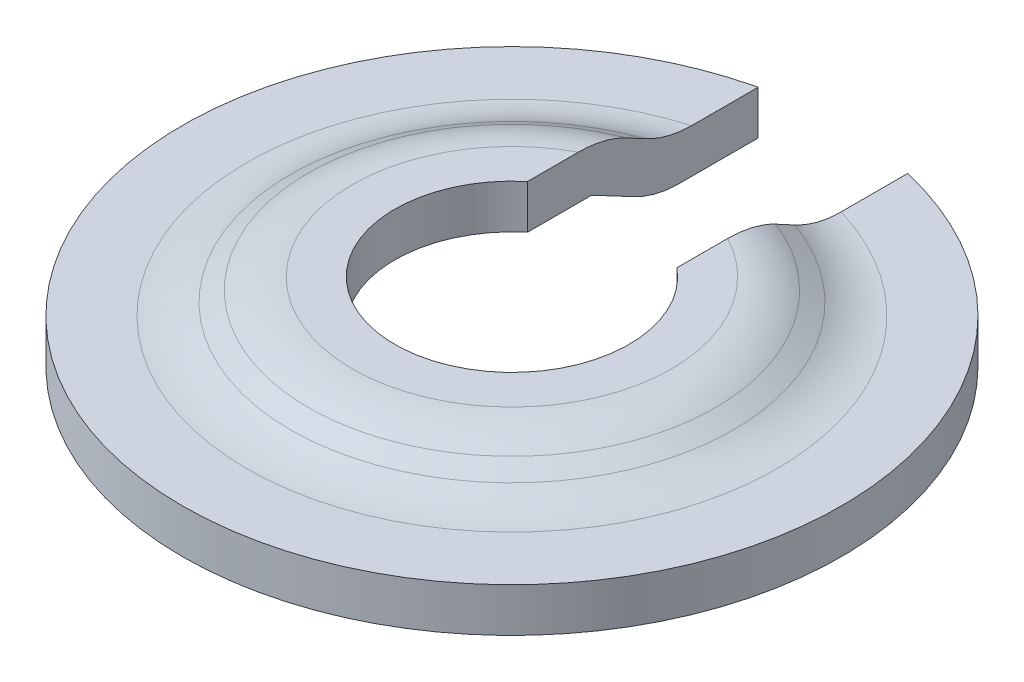
from build123d import *

# Parameters (mm, degrees)
CUT_EXTRUDE1_DEPTH = 33.258177258
FILLET1_R          = 6


with BuildPart() as part:
    # Sketch2 → Revolve1 (revolve)
    with BuildSketch(Plane.XY, mode=Mode.PRIVATE) as revolve1_sk:
        Polygon((8, 2.3), (8, 5.3), (12.5, 5.3), (16.5, 3), (22.5, 3), (22.5, 0), (15.698988524, 0), (11.698988524, 2.3), align=None)
    revolve(revolve1_sk.sketch.rotate(Axis((0, 0, 0), (0, 1, 0)), 90), axis=Axis((0, 0, 0), (0, 1, 0)))

    # Sketch3 → Cut-Extrude1 (cut, through all)
    with BuildSketch(Plane(origin=(0, 0, 0), x_dir=(1, 0, 0), z_dir=(0, 1, 0))):
        with BuildLine():
            Line((-5.1, 21.914378841), (-5.1, 6.163602842))
            ThreePointArc((-5.1, 6.163602842), (0, 8), (5.1, 6.163602842))
            Line((5.1, 6.163602842), (5.1, 21.914378841))
            ThreePointArc((5.1, 21.914378841), (0, 22.5), (-5.1, 21.914378841))
        make_face()
    extrude(amount=CUT_EXTRUDE1_DEPTH, mode=Mode.SUBTRACT)

    # Fillet1
    fillet1_edges = [part.edges().sort_by_distance(p)[0] for p in [
        (0, 0, 15.698988524),
        (0, 3, 16.5),
        (0, 5.3, 12.5),
    ]]
    fillet(fillet1_edges, radius=FILLET1_R)


solid = part.part
